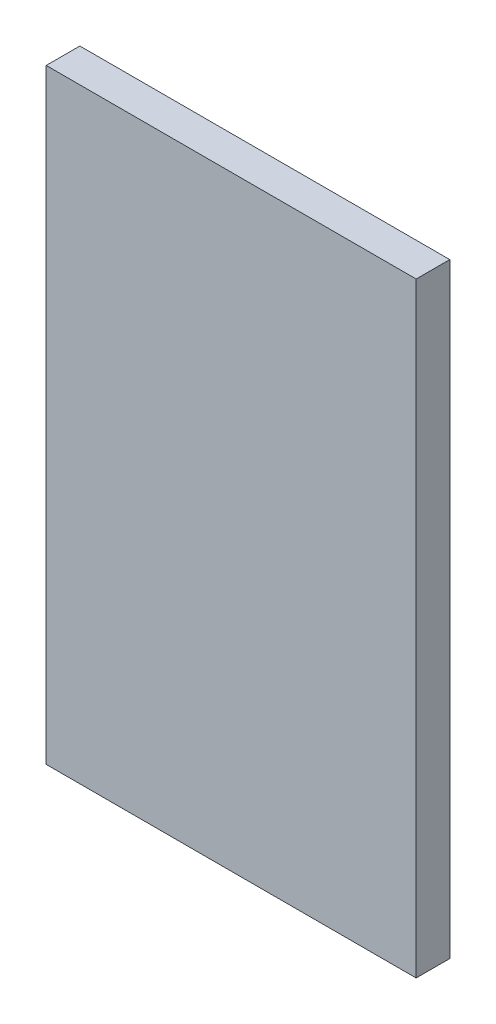
from build123d import *

# Parameters (mm, degrees)
SKETCH_1_W      = 550
SKETCH_1_H      = 900
EXTRUDE_1_DEPTH = 50


with BuildPart() as part:
    # Эскиз1 → Бобышка-Вытянуть1 (new body)
    with BuildSketch(Plane.XY):
        with Locations((275, 450)):
            Rectangle(SKETCH_1_W, SKETCH_1_H)
    extrude(amount=EXTRUDE_1_DEPTH)


solid = part.part
